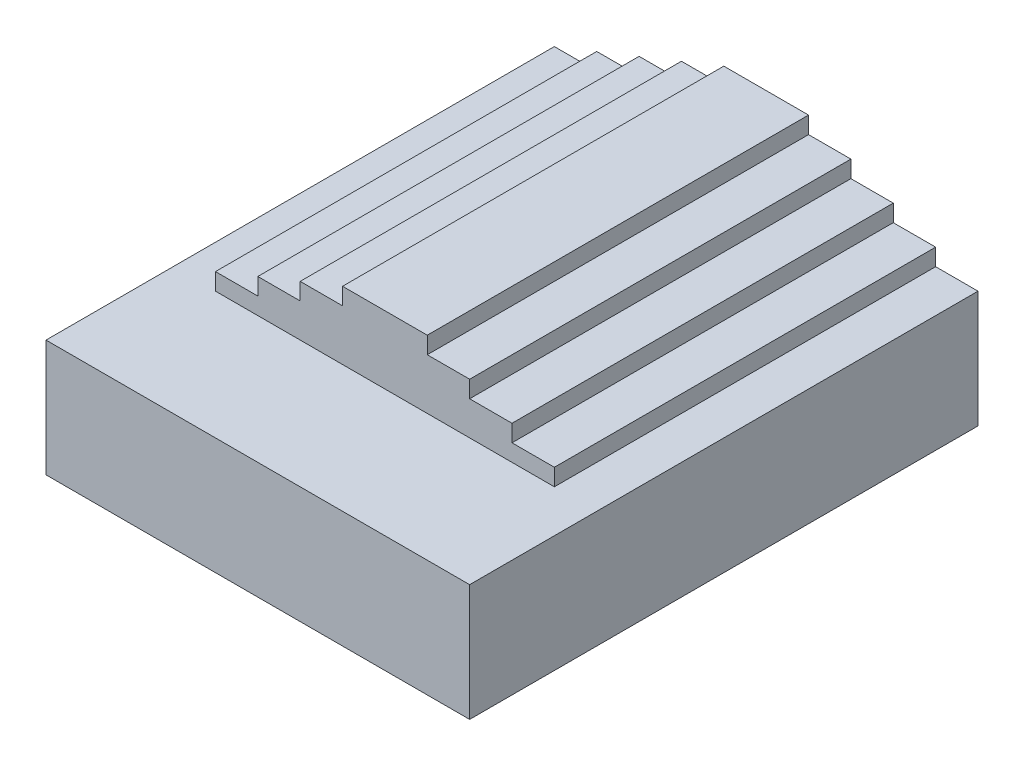
from build123d import *

# Parameters (mm, degrees)
EXTRUDE_1_DEPTH     = 60
SKETCH_3_W          = 15
SKETCH_3_H          = 8
CUT_EXTRUDE_1_DEPTH = 50


with BuildPart() as part:
    # 草图1 → 凸台-拉伸1 (new body)
    with BuildSketch(Plane.XY):
        Polygon((-37.017562776, 4), (-27.017562776, 4), (-27.017562776, 2), (-22.017562776, 2), (-22.017562776, 0), (-17.017562776, 0), (-17.017562776, -2), (-12.017562776, -2), (-12.017562776, -4), (-7.017562776, -4), (-7.017562776, -6), (-7.017562776, -17.776315497), (-57.017562776, -17.776315497), (-57.017562776, -6), (-57.017562776, -4), (-52.017562776, -4), (-52.017562776, -2), (-47.017562776, -2), (-47.017562776, 0), (-42.017562776, 0), (-42.017562776, 2), (-37.017562776, 2), align=None)
    extrude(amount=EXTRUDE_1_DEPTH)

    # 草图3 → 切除-拉伸1 (cut)
    with BuildSketch(Plane(origin=(-7.017562776, 0, 0), x_dir=(0, 0, -1), z_dir=(1, 0, 0))):
        with Locations((-52.5, 0)):
            Rectangle(SKETCH_3_W, SKETCH_3_H)
    extrude(amount=-CUT_EXTRUDE_1_DEPTH, mode=Mode.SUBTRACT)


solid = part.part
